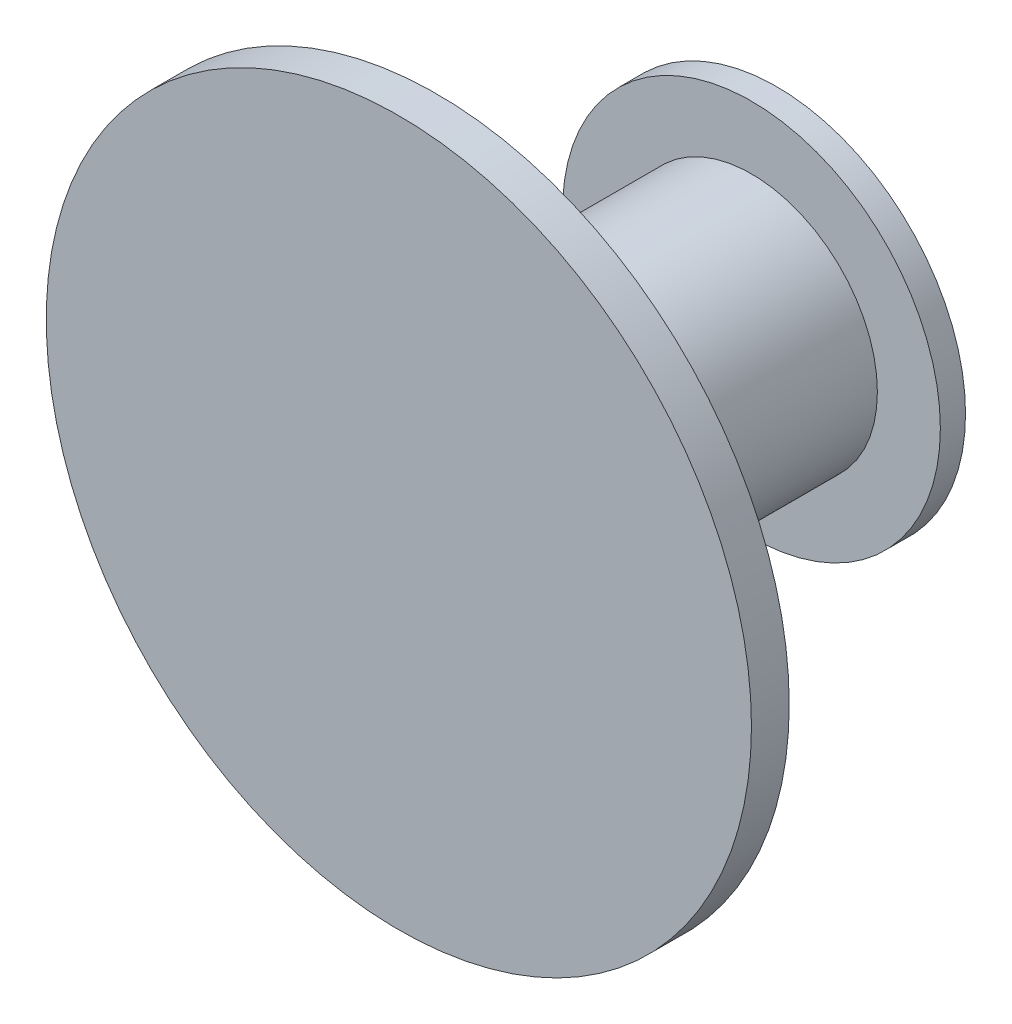
from build123d import *

# Parameters (mm, degrees)
SKETCH_1_R      = 150
EXTRUDE_1_DEPTH = 20
SKETCH_2_R      = 100
EXTRUDE_2_DEPTH = 250
SKETCH_3_R      = 280
EXTRUDE_3_DEPTH = 30


with BuildPart() as part:
    # 草图1 → 凸台-拉伸1 (new body)
    with BuildSketch(Plane.XY):
        Circle(SKETCH_1_R)
    extrude(amount=EXTRUDE_1_DEPTH)

    # 草图2 → 凸台-拉伸2 (add)
    with BuildSketch(Plane.XY.offset(20)):
        Circle(SKETCH_2_R)
    extrude(amount=EXTRUDE_2_DEPTH)

    # 草图3 → 凸台-拉伸3 (add)
    with BuildSketch(Plane.XY.offset(270)):
        Circle(SKETCH_3_R)
    extrude(amount=EXTRUDE_3_DEPTH)


solid = part.part
